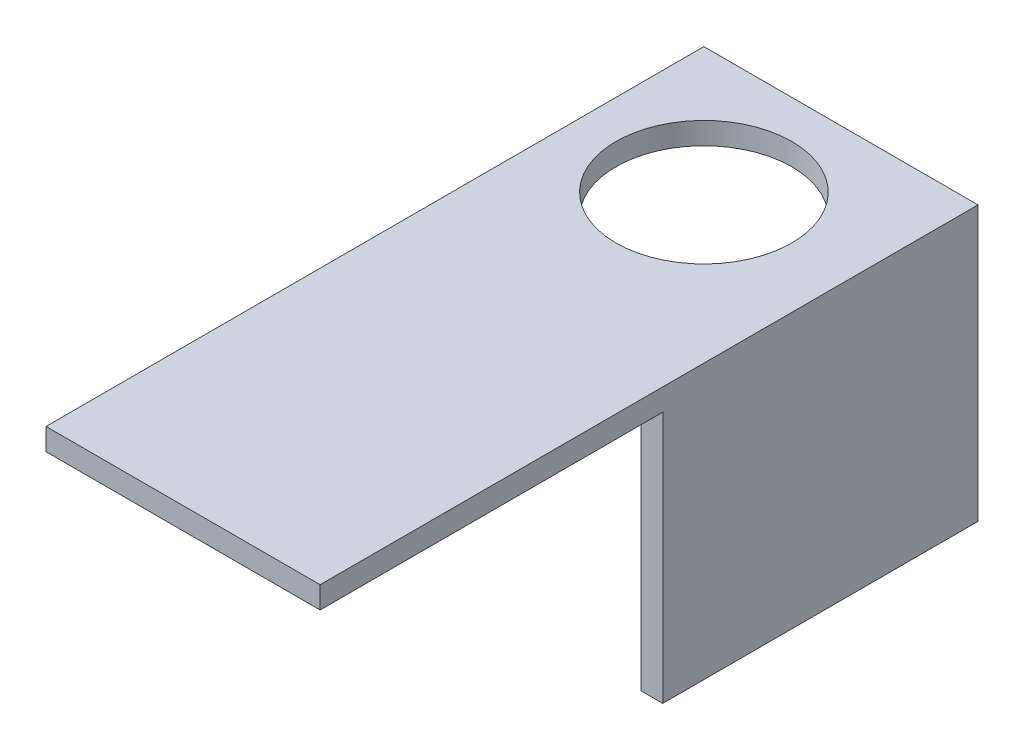
from build123d import *

# Parameters (mm, degrees)
SALIENTE_EXTRUIR1_DEPTH    = 120
CORTAR_EXTRUIR5_DEPTH      = 56
CORTAR_EXTRUIR5_DEPTH_BACK = 35
CROQUIS3_W                 = 62.5
CROQUIS3_H                 = 46
CORTAR_EXTRUIR6_DEPTH      = 40
CORTAR_EXTRUIR6_DEPTH_BACK = 42
CROQUIS4_R                 = 16.039805737


with BuildPart() as part:
    # Croquis1 → Saliente-Extruir1 (new body)
    with BuildSketch(Plane.XY):
        Polygon((-124.610735746, 44.963996627), (-74.610735746, 44.963996627), (-74.610735746, -5.036003373), (-78.610735746, -5.036003373), (-78.610735746, 40.963996627), (-124.610735746, 40.963996627), align=None)
    extrude(amount=SALIENTE_EXTRUIR1_DEPTH)

    # Croquis3 → Cortar-Extruir5 (cut, two sides: drawn at the far end of the back side and taken through both)
    with BuildSketch(Plane.ZY.offset(78.610735746).offset(-CORTAR_EXTRUIR5_DEPTH_BACK)):
        with Locations((88.75, 17.963996627)):
            Rectangle(CROQUIS3_W, CROQUIS3_H)
    extrude(amount=CORTAR_EXTRUIR5_DEPTH + CORTAR_EXTRUIR5_DEPTH_BACK, mode=Mode.SUBTRACT)

    # Croquis4 → Cortar-Extruir6 (cut, two sides: drawn at the far end of the back side and taken through both)
    with BuildSketch(Plane.XZ.offset(-40.963996627).offset(-CORTAR_EXTRUIR6_DEPTH_BACK)):
        with Locations(Location((-101.610735746, 23, 0), (0, 0, 270))):
            Circle(CROQUIS4_R)
    extrude(amount=CORTAR_EXTRUIR6_DEPTH + CORTAR_EXTRUIR6_DEPTH_BACK, mode=Mode.SUBTRACT)


solid = part.part
